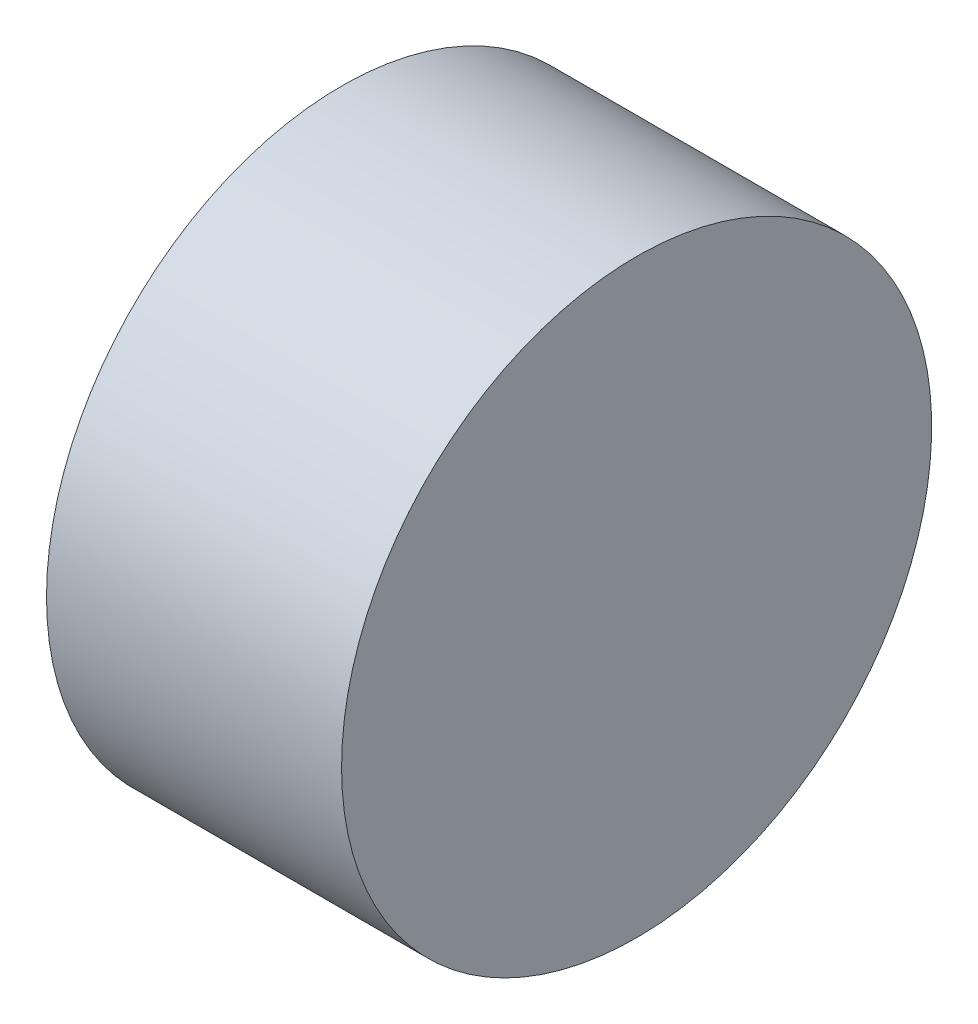
from build123d import *

# Parameters (mm, degrees)
SKETCH_1_W = 100
SKETCH_1_H = 100


with BuildPart() as part:
    # 草图1 → 旋转1 (revolve)
    with BuildSketch(Plane(origin=(0, 0, 0), x_dir=(1, 0, 0), z_dir=(0, 1, 0))):
        Rectangle(SKETCH_1_W, SKETCH_1_H)
    revolve(axis=Axis((-50, 0, -50), (1, 0, 0)))


solid = part.part
